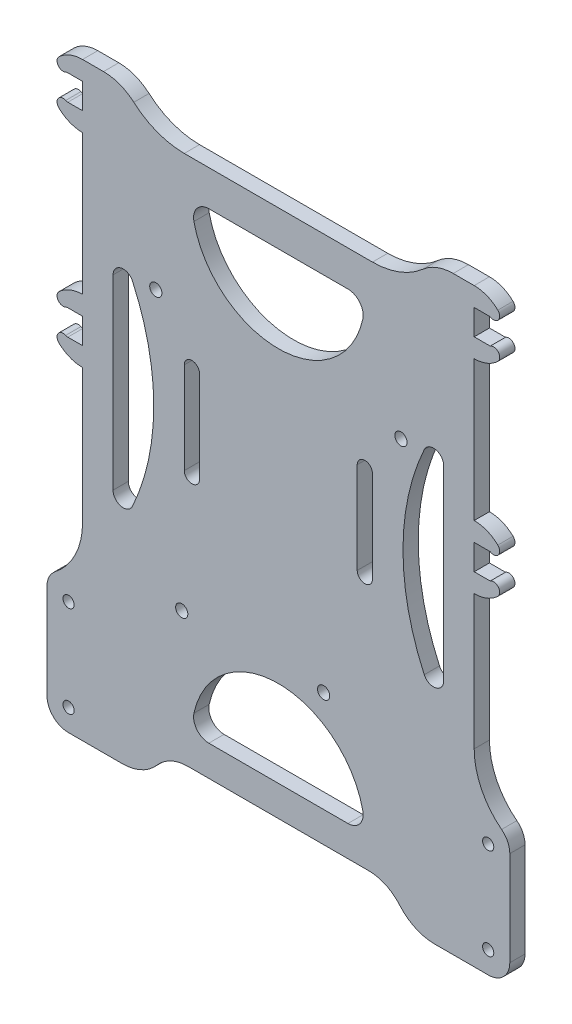
from build123d import *

# Parameters (mm, degrees)
SKETCH2_R            = 1.1
SKETCH2_R_2          = 1.2
BOSS_EXTRUDE4_DEPTH  = 3
FILLET2_R            = 9
FILLET3_R            = 4.2
CUT_EXTRUDE1_DEPTH   = 17
FILLET4_R            = 3
FILLET5_R            = 2
SKETCH6_R            = 1.2
BOSS_EXTRUDE6_DEPTH  = 3
FILLET6_R            = 1
FILLET4_OF_MIRROR1_R = 3
FILLET5_OF_MIRROR1_R = 2


with BuildPart() as part:
    # Sketch2 → Boss-Extrude4 (new body)
    # profile 1 of 7: a face of its own
    with BuildSketch(Plane.XY):
        with BuildLine():
            ThreePointArc((27, 110), (20.291796068, 111.583592135), (15, 116))
            Line((15, 116), (15, 110))
            Line((15, 110), (27, 110))
        make_face()
    # profile 2 of 7: a face of its own
    with BuildSketch(Plane.XY):
        with BuildLine():
            ThreePointArc((76, 116), (70.708203932, 111.583592135), (64, 110))
            Line((64, 110), (76, 110))
            Line((76, 110), (76, 116))
        make_face()
    # profile 3 of 7: a face of its own
    with BuildSketch(Plane.XY):
        Polygon((20, 0), (0, 0), (0, 25), (7, 25), (7, 116), (15, 116), (15, 110), (76, 110), (76, 116), (84, 116), (84, 25), (91, 25), (91, 0), (71, 0), (71, 6), (20, 6), align=None)
        with Locations((86.75, 22.3)):
            Circle(SKETCH2_R, mode=Mode.SUBTRACT)
        with Locations((21.4, 84)):
            Circle(SKETCH2_R_2, mode=Mode.SUBTRACT)
        with Locations((69.6, 82.7)):
            Circle(SKETCH2_R_2, mode=Mode.SUBTRACT)
        with Locations((54.4, 31.9)):
            Circle(SKETCH2_R_2, mode=Mode.SUBTRACT)
        with Locations((26.5, 31.9)):
            Circle(SKETCH2_R_2, mode=Mode.SUBTRACT)
        with Locations((4.25, 22.3)):
            Circle(SKETCH2_R, mode=Mode.SUBTRACT)
        with Locations((4.25, 4.3)):
            Circle(SKETCH2_R, mode=Mode.SUBTRACT)
        with Locations((86.75, 4.3)):
            Circle(SKETCH2_R, mode=Mode.SUBTRACT)
        with BuildLine():
            ThreePointArc((30, 74), (28.5, 75.5), (27, 74))
            Line((27, 74), (27, 56))
            ThreePointArc((27, 56), (28.5, 54.5), (30, 56))
            Line((30, 56), (30, 74))
        make_face(mode=Mode.SUBTRACT)
        with BuildLine():
            Line((61, 56), (61, 74))
            ThreePointArc((61, 74), (62.5, 75.5), (64, 74))
            Line((64, 74), (64, 56))
            ThreePointArc((64, 56), (62.5, 54.5), (61, 56))
        make_face(mode=Mode.SUBTRACT)
    # profile 4 of 7: a face of its own
    with BuildSketch(Plane.XY):
        with BuildLine():
            ThreePointArc((7, 37.124355653), (5.124355653, 30.124355653), (0, 25))
            Line((0, 25), (7, 25))
            Line((7, 25), (7, 37.124355653))
        make_face()
    # profile 5 of 7: a face of its own
    with BuildSketch(Plane.XY):
        with BuildLine():
            Line((84, 25), (91, 25))
            ThreePointArc((91, 25), (85.875644326, 30.124355689), (84, 37.124355736))
            Line((84, 37.124355736), (84, 25))
        make_face()
    # profile 6 of 7: a face of its own
    with BuildSketch(Plane.XY):
        with BuildLine():
            Line((71, 6), (63.254033308, 6))
            ThreePointArc((63.254033308, 6), (68.153012793, 4.32455532), (71, 0))
            Line((71, 0), (71, 6))
        make_face()
    # profile 7 of 7: a face of its own
    with BuildSketch(Plane.XY):
        with BuildLine():
            Line((20, 6), (20, 0))
            ThreePointArc((20, 0), (22.846987207, 4.32455532), (27.745966692, 6))
            Line((27.745966692, 6), (20, 6))
        make_face()
    extrude(amount=BOSS_EXTRUDE4_DEPTH)

    # Fillet2
    fillet2_edges = [part.edges().sort_by_distance(p)[0] for p in [
        (15, 116, 1.5),
        (76, 116, 1.5),
        (71, 0, 1.5),
        (20, 0, 1.5),
    ]]
    fillet(fillet2_edges, radius=FILLET2_R)

    # Fillet3
    fillet3_edges = [part.edges().sort_by_distance(p)[0] for p in [
        (0, 0, 1.5),
        (0, 25, 1.5),
        (91, 25, 1.5),
        (91, 0, 1.5),
    ]]
    fillet(fillet3_edges, radius=FILLET3_R)

    # Sketch3 → Cut-Extrude1 (cut)
    with BuildSketch(Plane.XY.offset(3)):
        with BuildLine():
            ThreePointArc((21, 64), (18.954521952, 77.564659966), (13, 89.922962794))
            Line((13, 89.922962794), (13, 38.077037206))
            ThreePointArc((13, 38.077037206), (18.954521952, 50.435340034), (21, 64))
        make_face()
        with BuildLine():
            Line((28.5, 103), (45.5, 103))
            Line((45.5, 103), (45.5, 86))
            ThreePointArc((45.5, 86), (33.47918472, 90.97918472), (28.5, 103))
        make_face()
        with BuildLine():
            Line((45.5, 12), (45.5, 29))
            ThreePointArc((45.5, 29), (33.47918472, 24.02081528), (28.5, 12))
            Line((28.5, 12), (45.5, 12))
        make_face()
    cut_extrude1 = extrude(amount=-CUT_EXTRUDE1_DEPTH, mode=Mode.SUBTRACT)

    # Fillet4
    fillet4_edges = [part.edges().sort_by_distance(p)[0] for p in [
        (28.5, 103, 1.5),
        (28.5, 12, 1.5),
    ]]
    fillet(fillet4_edges, radius=FILLET4_R)

    # Fillet5
    fillet5_edges = [part.edges().sort_by_distance(p)[0] for p in [
        (13, 38.077037206, 1.5),
        (13, 89.922962794, 1.5),
    ]]
    fillet(fillet5_edges, radius=FILLET5_R)

    # Sketch6 → Boss-Extrude6 (add)
    with BuildSketch(Plane.XY.offset(3)):
        with BuildLine():
            ThreePointArc((4.386675042, 113.273568309), (4.244027857, 112.706113443), (3.85, 112.273568309))
            Line((3.85, 112.273568309), (7, 112.273568309))
            Line((7, 112.273568309), (7, 116))
            ThreePointArc((7, 116), (4.500310829, 115.51828106), (2.358656251, 114.142121636))
            ThreePointArc((2.358656251, 114.142121636), (3.659103582, 114.376659998), (4.386675042, 113.273568309))
        make_face()
        with Locations((3.186675042, 113.273568309)):
            Circle(SKETCH6_R)
        with Locations((3.186675042, 106.273568309)):
            Circle(SKETCH6_R)
        with BuildLine():
            ThreePointArc((4.386675042, 106.273568309), (3.659103582, 105.17047662), (2.358656251, 105.405014982))
            ThreePointArc((2.358656251, 105.405014982), (4.500310829, 104.028855558), (7, 103.547136618))
            Line((7, 103.547136618), (7, 107.273568309))
            Line((7, 107.273568309), (3.85, 107.273568309))
            ThreePointArc((3.85, 107.273568309), (4.244027857, 106.841023175), (4.386675042, 106.273568309))
        make_face()
        with Locations((3.186675042, 73.273568309)):
            Circle(SKETCH6_R)
        with BuildLine():
            ThreePointArc((4.386675042, 73.273568309), (4.244027857, 72.706113443), (3.85, 72.273568309))
            Line((3.85, 72.273568309), (7, 72.273568309))
            Line((7, 72.273568309), (7, 76))
            ThreePointArc((7, 76), (4.500310865, 75.518281074), (2.358656308, 74.14212169))
            ThreePointArc((2.358656308, 74.14212169), (3.659103618, 74.376659983), (4.386675042, 73.273568309))
        make_face()
        with Locations((3.186675042, 66.273568309)):
            Circle(SKETCH6_R)
        with BuildLine():
            ThreePointArc((4.386675042, 66.273568309), (3.659103622, 65.170476637), (2.358656313, 65.405014923))
            ThreePointArc((2.358656313, 65.405014923), (4.500310869, 64.028855542), (7, 63.547136618))
            Line((7, 63.547136618), (7, 67.273568309))
            Line((7, 67.273568309), (3.85, 67.273568309))
            ThreePointArc((3.85, 67.273568309), (4.244027857, 66.841023175), (4.386675042, 66.273568309))
        make_face()
    boss_extrude6 = extrude(amount=-BOSS_EXTRUDE6_DEPTH)

    # Fillet6
    fillet6_edges = [part.edges().sort_by_distance(p)[0] for p in [
        (3.85, 112.273568309, 1.5),
        (3.85, 107.273568309, 1.5),
        (3.85, 72.273568309, 1.5),
        (3.85, 67.273568309, 1.5),
    ]]
    fillet(fillet6_edges, radius=FILLET6_R)

    # Mirror1: Cut-Extrude1, Boss-Extrude6 across plane
    add(cut_extrude1.mirror(Plane(origin=(45.5, 0, -14), x_dir=(0, 0, 1), z_dir=(-1, 0, 0))), mode=Mode.SUBTRACT)
    add(boss_extrude6.mirror(Plane(origin=(45.5, 0, -14), x_dir=(0, 0, 1), z_dir=(-1, 0, 0))))

    # Fillet4 of Mirror1
    fillet4_of_mirror1_edges = [part.edges().sort_by_distance(p)[0] for p in [
        (62.5, 103, 1.5),
        (62.5, 12, 1.5),
    ]]
    fillet(fillet4_of_mirror1_edges, radius=FILLET4_OF_MIRROR1_R)

    # Fillet5 of Mirror1
    fillet5_of_mirror1_edges = [part.edges().sort_by_distance(p)[0] for p in [
        (78, 38.077037206, 1.5),
        (78, 89.922962794, 1.5),
    ]]
    fillet(fillet5_of_mirror1_edges, radius=FILLET5_OF_MIRROR1_R)


solid = part.part
